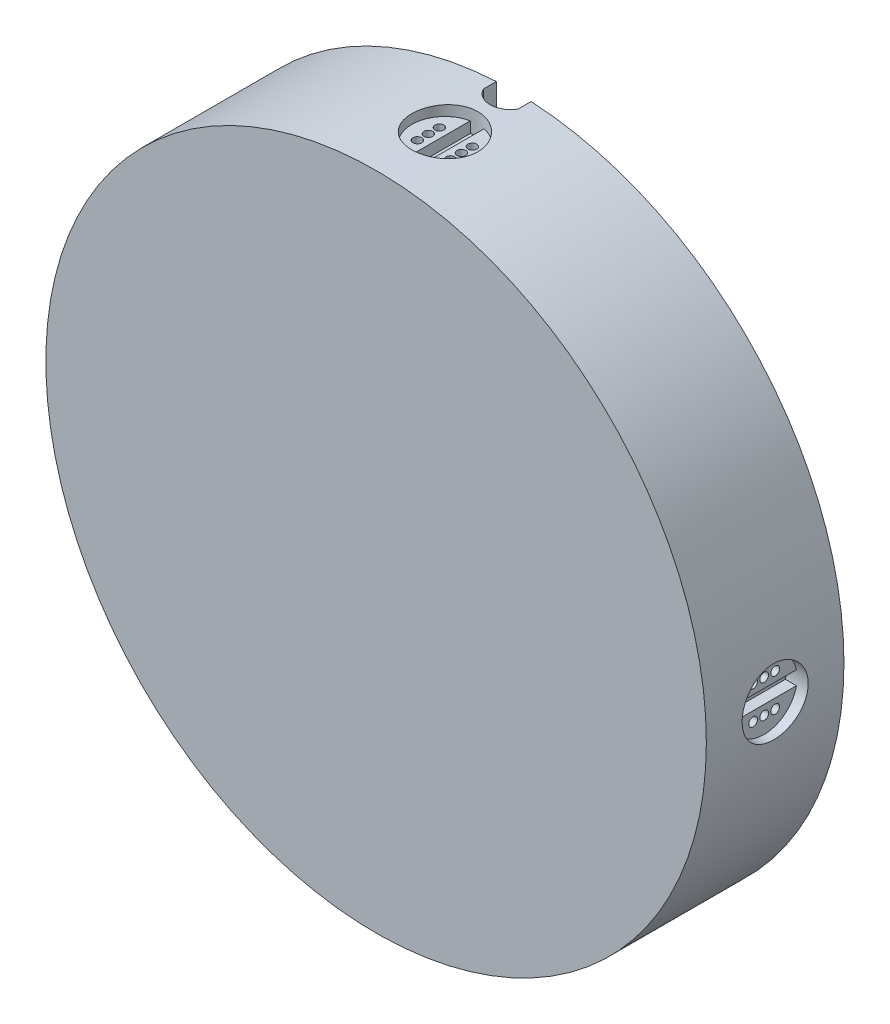
from build123d import *

# Parameters (mm, degrees)
SKETCH3_R               = 76.2
BOSS_EXTRUDE1_DEPTH     = 31.75
SKETCH5_R               = 7.62
CUT_EXTRUDE1_DEPTH      = 2.54
SKETCH6_R               = 68.58
CUT_EXTRUDE2_DEPTH      = 21.59
CIRPATTERN1_COUNT       = 4
CUT_EXTRUDE4_REACH      = 173.092
CUT_EXTRUDE4_END_RADIUS = 68.58
SKETCH12_R              = 1.016
CIRPATTERN6_COUNT       = 4
CUT_EXTRUDE6_DEPTH      = 2.54
CIRPATTERN7_COUNT       = 4
SKETCH15_R              = 2.5
SKETCH15_R_2            = 1.1
BOSS_EXTRUDE2_DEPTH     = 10
CUT_EXTRUDE7_DEPTH      = 10
SKETCH19_R              = 2
CUT_EXTRUDE8_DEPTH      = 5


with BuildPart() as part:
    # Sketch3 → Boss-Extrude1 (new body)
    with BuildSketch(Plane(origin=(0, 0, 0), x_dir=(0, 1, 0), z_dir=(0, 0, 1))):
        with Locations(Location((0, 0, 0), (0, 0, 270))):
            Circle(SKETCH3_R)
    extrude(amount=-BOSS_EXTRUDE1_DEPTH)

    # Sketch5 → Cut-Extrude1 (cut)
    with BuildSketch(Plane(origin=(0, 76.2, 0), x_dir=(-1, 0, 0), z_dir=(0, 1, 0))):
        with Locations(Location((0, -15.875, 0), (0, 0, 90))):
            Circle(SKETCH5_R)
    cut_extrude1 = extrude(amount=-CUT_EXTRUDE1_DEPTH, mode=Mode.SUBTRACT)

    # Sketch6 → Cut-Extrude2 (cut)
    with BuildSketch(Plane(origin=(0, 0, -31.75), x_dir=(1, 0, 0), z_dir=(0, 0, -1))):
        with Locations(Location((0, 0, 0), (0, 0, 180))):
            Circle(SKETCH6_R)
    extrude(amount=-CUT_EXTRUDE2_DEPTH, mode=Mode.SUBTRACT)

    # CirPattern1: Cut-Extrude1 ×4 about axis
    cirpattern1_axis = Axis((0, 0, 0), (0, 0, 1))
    for i in range(1, CIRPATTERN1_COUNT):
        add(cut_extrude1.rotate(cirpattern1_axis, i * 360 / CIRPATTERN1_COUNT), mode=Mode.SUBTRACT)

    # Cut-Extrude4: up to this cylinder (the profile starts outside it)
    cut_extrude4_end = Plane(origin=(0, 0, -15.875), z_dir=(0, 0, -1)) * Cylinder(CUT_EXTRUDE4_END_RADIUS, 489.424, mode=Mode.PRIVATE)
    # Sketch12 → Cut-Extrude4 (cut, up to the surface)
    with BuildSketch(Plane.YZ.offset(73.66), mode=Mode.PRIVATE) as cut_extrude4_sk1:
        with Locations((3.81, -18.415)):
            Circle(SKETCH12_R)
    cut_extrude4_tool1 = extrude(cut_extrude4_sk1.sketch, amount=-CUT_EXTRUDE4_REACH, mode=Mode.PRIVATE) - cut_extrude4_end
    # Sketch12 → Cut-Extrude4 (cut, up to the surface)
    with BuildSketch(Plane.YZ.offset(73.66), mode=Mode.PRIVATE) as cut_extrude4_sk2:
        with Locations((3.81, -15.875)):
            Circle(SKETCH12_R)
    cut_extrude4_tool2 = extrude(cut_extrude4_sk2.sketch, amount=-CUT_EXTRUDE4_REACH, mode=Mode.PRIVATE) - cut_extrude4_end
    # Sketch12 → Cut-Extrude4 (cut, up to the surface)
    with BuildSketch(Plane.YZ.offset(73.66), mode=Mode.PRIVATE) as cut_extrude4_sk3:
        with Locations((3.81, -13.335)):
            Circle(SKETCH12_R)
    cut_extrude4_tool3 = extrude(cut_extrude4_sk3.sketch, amount=-CUT_EXTRUDE4_REACH, mode=Mode.PRIVATE) - cut_extrude4_end
    # Sketch12 → Cut-Extrude4 (cut, up to the surface)
    with BuildSketch(Plane.YZ.offset(73.66), mode=Mode.PRIVATE) as cut_extrude4_sk4:
        with Locations((-3.81, -18.415)):
            Circle(SKETCH12_R)
    cut_extrude4_tool4 = extrude(cut_extrude4_sk4.sketch, amount=-CUT_EXTRUDE4_REACH, mode=Mode.PRIVATE) - cut_extrude4_end
    # Sketch12 → Cut-Extrude4 (cut, up to the surface)
    with BuildSketch(Plane.YZ.offset(73.66), mode=Mode.PRIVATE) as cut_extrude4_sk5:
        with Locations((-3.81, -15.875)):
            Circle(SKETCH12_R)
    cut_extrude4_tool5 = extrude(cut_extrude4_sk5.sketch, amount=-CUT_EXTRUDE4_REACH, mode=Mode.PRIVATE) - cut_extrude4_end
    # Sketch12 → Cut-Extrude4 (cut, up to the surface)
    with BuildSketch(Plane.YZ.offset(73.66), mode=Mode.PRIVATE) as cut_extrude4_sk6:
        with Locations((-3.81, -13.335)):
            Circle(SKETCH12_R)
    cut_extrude4_tool6 = extrude(cut_extrude4_sk6.sketch, amount=-CUT_EXTRUDE4_REACH, mode=Mode.PRIVATE) - cut_extrude4_end
    cut_extrude4 = cut_extrude4_tool1.solids().sort_by_distance((73.66, 3.81, -18.415))[0] + cut_extrude4_tool2.solids().sort_by_distance((73.66, 3.81, -15.875))[0] + cut_extrude4_tool3.solids().sort_by_distance((73.66, 3.81, -13.335))[0] + cut_extrude4_tool4.solids().sort_by_distance((73.66, -3.81, -18.415))[0] + cut_extrude4_tool5.solids().sort_by_distance((73.66, -3.81, -15.875))[0] + cut_extrude4_tool6.solids().sort_by_distance((73.66, -3.81, -13.335))[0]
    add(cut_extrude4, mode=Mode.SUBTRACT)

    # CirPattern6: Cut-Extrude4 ×4 about axis
    cirpattern6_axis = Axis((0, 0, 0), (0, 0, 1))
    for i in range(1, CIRPATTERN6_COUNT):
        add(cut_extrude4.rotate(cirpattern6_axis, i * 360 / CIRPATTERN6_COUNT), mode=Mode.SUBTRACT)

    # Sketch14 → Cut-Extrude6 (cut)
    with BuildSketch(Plane.YZ.offset(73.66)):
        with BuildLine():
            Line((-1.5875, -23.327801067), (-1.5875, -8.422198933))
            ThreePointArc((-1.5875, -8.422198933), (0, -8.255), (1.5875, -8.422198933))
            Line((1.5875, -8.422198933), (1.5875, -23.327801067))
            ThreePointArc((1.5875, -23.327801067), (0, -23.495), (-1.5875, -23.327801067))
        make_face()
    cut_extrude6 = extrude(amount=-CUT_EXTRUDE6_DEPTH, mode=Mode.SUBTRACT)

    # CirPattern7: Cut-Extrude6 ×4 about axis
    cirpattern7_axis = Axis((0, 0, 0), (0, 0, 1))
    for i in range(1, CIRPATTERN7_COUNT):
        add(cut_extrude6.rotate(cirpattern7_axis, i * 360 / CIRPATTERN7_COUNT), mode=Mode.SUBTRACT)

    # Sketch15 → Boss-Extrude2 (add)
    # profile 1 of 4: a face of its own
    with BuildSketch(Plane(origin=(0, 0, -10.16), x_dir=(1, 0, 0), z_dir=(0, 0, -1))):
        with Locations(Location((-5.7, -23.5, 0), (0, 0, 180))):
            Circle(SKETCH15_R)
        with Locations(Location((-5.7, -23.5, 0), (0, 0, 180))):
            Circle(SKETCH15_R_2, mode=Mode.SUBTRACT)
    # profile 2 of 4: a face of its own
    with BuildSketch(Plane(origin=(0, 0, -10.16), x_dir=(1, 0, 0), z_dir=(0, 0, -1))):
        with Locations(Location((4.3, -23.5, 0), (0, 0, 180))):
            Circle(SKETCH15_R)
        with Locations(Location((4.3, -23.5, 0), (0, 0, 180))):
            Circle(SKETCH15_R_2, mode=Mode.SUBTRACT)
    # profile 3 of 4: a face of its own
    with BuildSketch(Plane(origin=(0, 0, -10.16), x_dir=(1, 0, 0), z_dir=(0, 0, -1))):
        with Locations((4.3, 23.5)):
            Circle(SKETCH15_R)
        with Locations((4.3, 23.5)):
            Circle(SKETCH15_R_2, mode=Mode.SUBTRACT)
    # profile 4 of 4: a face of its own
    with BuildSketch(Plane(origin=(0, 0, -10.16), x_dir=(1, 0, 0), z_dir=(0, 0, -1))):
        with Locations((-5.7, 23.5)):
            Circle(SKETCH15_R)
        with Locations((-5.7, 23.5)):
            Circle(SKETCH15_R_2, mode=Mode.SUBTRACT)
    extrude(amount=BOSS_EXTRUDE2_DEPTH)

    # Sketch16 → Cut-Extrude7 (cut)
    with BuildSketch(Plane(origin=(0, 76.2, 0), x_dir=(-1, 0, 0), z_dir=(0, 1, 0))):
        with BuildLine():
            Line((0, -31.75), (4, -31.75))
            Line((4, -31.75), (4, -28.75))
            ThreePointArc((4, -28.75), (0, -26.297633884), (-4, -28.75))
            Line((-4, -28.75), (-4, -31.75))
            Line((-4, -31.75), (0, -31.75))
        make_face()
    extrude(amount=-CUT_EXTRUDE7_DEPTH, mode=Mode.SUBTRACT)

    # Sketch19 → Cut-Extrude8 (cut)
    with BuildSketch(Plane(origin=(0, 0, -31.75), x_dir=(-1, 0, 0), z_dir=(0, 0, -1))):
        with Locations((51.18745989, 51.18745989)):
            Circle(SKETCH19_R)
        with Locations((51.18745989, -51.18745989)):
            Circle(SKETCH19_R)
        with Locations((-51.18745989, -51.18745989)):
            Circle(SKETCH19_R)
        with Locations((-51.18745989, 51.18745989)):
            Circle(SKETCH19_R)
    extrude(amount=-CUT_EXTRUDE8_DEPTH, mode=Mode.SUBTRACT)


solid = part.part
